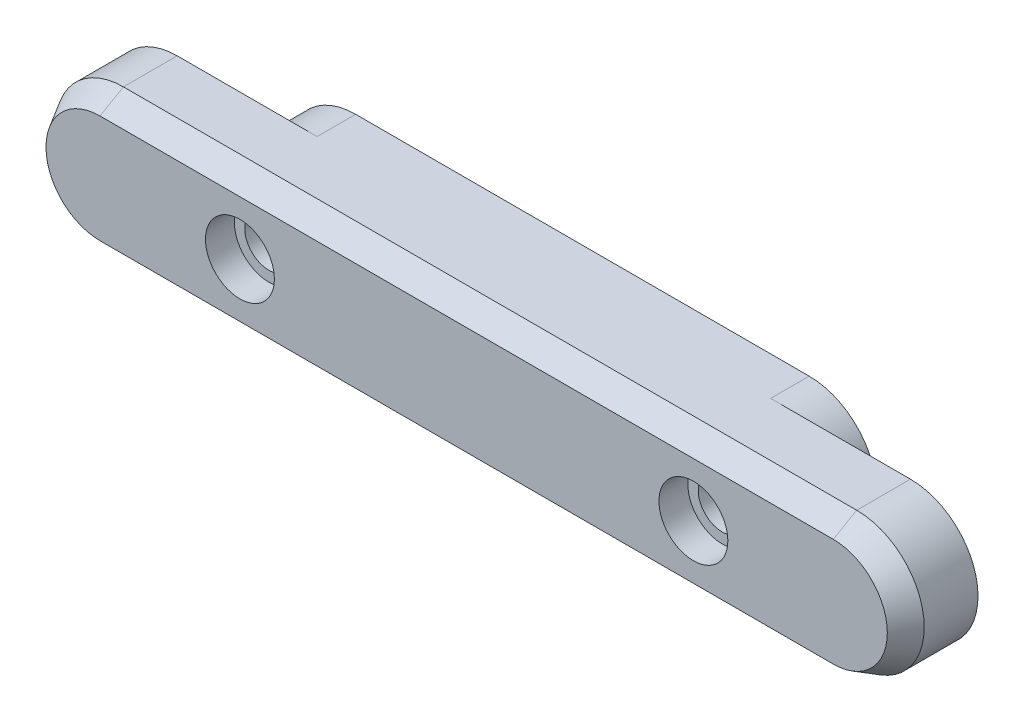
from build123d import *

# Parameters (mm, degrees)
SKETCH1_R           = 1.25
BOSS_EXTRUDE1_DEPTH = 4
CHAMFER1_SIZE       = 0.7
CHAMFER1_SIZE2      = 1.212435565
SKETCH2_R           = 1.78594
BOSS_EXTRUDE2_DEPTH = 2
SKETCH3_R           = 1.25
CUT_EXTRUDE1_DEPTH  = 3.5
SKETCH4_R           = 1.78594
CUT_EXTRUDE2_DEPTH  = 1.5


with BuildPart() as part:
    # Sketch1 → Boss-Extrude1 (new body)
    with BuildSketch(Plane.XY):
        with BuildLine():
            Line((19, 3.5), (-19, 3.5))
            ThreePointArc((-19, 3.5), (-22.5, 0), (-19, -3.5))
            Line((-19, -3.5), (19, -3.5))
            ThreePointArc((19, -3.5), (22.5, 0), (19, 3.5))
        make_face()
        with Locations((-11.75, 0)):
            Circle(SKETCH1_R, mode=Mode.SUBTRACT)
        with Locations((11.75, 0)):
            Circle(SKETCH1_R, mode=Mode.SUBTRACT)
    extrude(amount=BOSS_EXTRUDE1_DEPTH)

    # Chamfer1
    chamfer1_edges = [part.edges().sort_by_distance(p)[0] for p in [
        (0, -3.5, 4),
        (-22.5, 0, 4),
        (22.5, 0, 4),
        (0, 3.5, 4),
    ]]
    chamfer1_side = [part.faces().sort_by_distance(p)[0] for p in [
        (0, 0, 4),
    ]]
    chamfer(chamfer1_edges, length=CHAMFER1_SIZE, length2=CHAMFER1_SIZE2, reference=chamfer1_side[0])

    # Sketch2 → Boss-Extrude2 (add)
    with BuildSketch(Plane(origin=(0, 0, 0), x_dir=(-1, 0, 0), z_dir=(0, 0, -1))):
        with BuildLine():
            Line((11.75, 3.5), (-11.75, 3.5))
            ThreePointArc((-11.75, 3.5), (-15.25, 0), (-11.75, -3.5))
            Line((-11.75, -3.5), (11.75, -3.5))
            ThreePointArc((11.75, -3.5), (15.25, 0), (11.75, 3.5))
        make_face()
        with Locations((11.75, 0)):
            Circle(SKETCH2_R, mode=Mode.SUBTRACT)
        with Locations((-11.75, 0)):
            Circle(SKETCH2_R, mode=Mode.SUBTRACT)
    extrude(amount=BOSS_EXTRUDE2_DEPTH)

    # Sketch3 → Cut-Extrude1 (cut)
    with BuildSketch(Plane(origin=(0, 0, 0), x_dir=(-1, 0, 0), z_dir=(0, 0, -1))):
        with Locations((-19, 0)):
            Circle(SKETCH3_R)
        with Locations((19, 0)):
            Circle(SKETCH3_R)
    extrude(amount=-CUT_EXTRUDE1_DEPTH, mode=Mode.SUBTRACT)

    # Sketch4 → Cut-Extrude2 (cut)
    with BuildSketch(Plane.XY.offset(4)):
        with Locations((-11.75, 0)):
            Circle(SKETCH4_R)
        with Locations((11.75, 0)):
            Circle(SKETCH4_R)
    extrude(amount=-CUT_EXTRUDE2_DEPTH, mode=Mode.SUBTRACT)


solid = part.part
